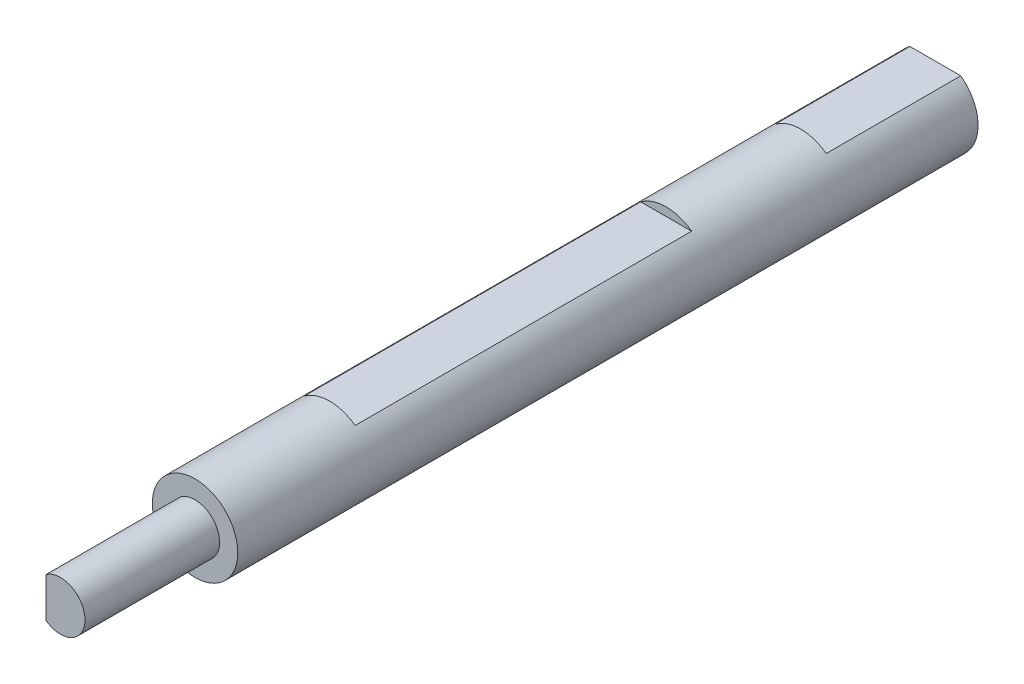
from build123d import *

# Parameters (mm, degrees)
SKETCH1_R           = 3.175
BOSS_EXTRUDE1_DEPTH = 65
CUT_EXTRUDE1_DEPTH  = 10
CUT_EXTRUDE2_DEPTH  = 25
CUT_EXTRUDE3_START  = -10
SKETCH4_R           = 3.175
CUT_EXTRUDE3_DEPTH  = 10


with BuildPart() as part:
    # Sketch1 → Boss-Extrude1 (new body)
    with BuildSketch(Plane.XY):
        Circle(SKETCH1_R)
    extrude(amount=BOSS_EXTRUDE1_DEPTH)

    # Sketch2 → Cut-Extrude1 (cut)
    with BuildSketch(Plane(origin=(0, 0, 0), x_dir=(-1, 0, 0), z_dir=(0, 0, -1))):
        with BuildLine():
            Line((-1.891593244, 2.55), (1.891593244, 2.55))
            ThreePointArc((1.891593244, 2.55), (0, 3.175), (-1.891593244, 2.55))
        make_face()
        with BuildLine():
            Line((-1.891593244, -2.55), (1.891593244, -2.55))
            ThreePointArc((1.891593244, -2.55), (0, -3.175), (-1.891593244, -2.55))
        make_face()
    extrude(amount=-CUT_EXTRUDE1_DEPTH, mode=Mode.SUBTRACT)

    # Sketch3 → Cut-Extrude2 (cut)
    with BuildSketch(Plane(origin=(0, 0, 20), x_dir=(-1, 0, 0), z_dir=(0, 0, -1))):
        with BuildLine():
            Line((-1.891593244, 2.55), (1.891593244, 2.55))
            ThreePointArc((1.891593244, 2.55), (0, 3.175), (-1.891593244, 2.55))
        make_face()
    extrude(amount=-CUT_EXTRUDE2_DEPTH, mode=Mode.SUBTRACT)

    # Sketch4 → Cut-Extrude3 (cut)
    with BuildSketch(Plane.XY.offset(65).offset(CUT_EXTRUDE3_START)):
        with Locations(Location((0, 0, 0), (0, 0, 126.568071017))):
            Circle(SKETCH4_R)
        with BuildLine():
            Line((-1.073, -1.478715659), (-1.073, 1.478715659))
            ThreePointArc((-1.073, 1.478715659), (1.827, 0), (-1.073, -1.478715659))
        make_face(mode=Mode.SUBTRACT)
    extrude(amount=CUT_EXTRUDE3_DEPTH, mode=Mode.SUBTRACT)


solid = part.part
